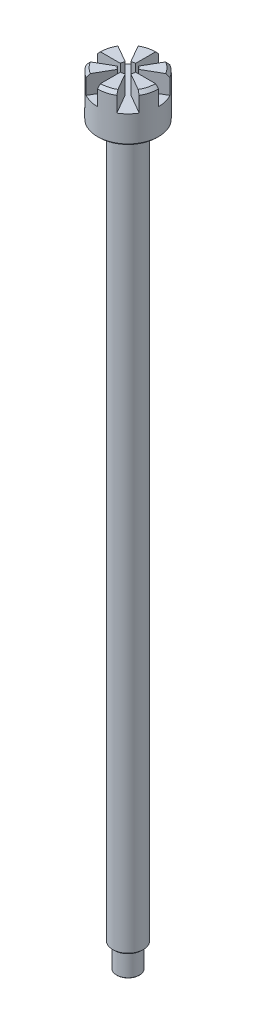
from build123d import *

# Parameters (mm, degrees)
CHAMFER1_SIZE      = 2
CUT_EXTRUDE1_DEPTH = 12
CIRPATTERN6_COUNT  = 6
CUT_EXTRUDE2_START = -12
SKETCH3_R          = 5
CUT_EXTRUDE2_DEPTH = 12
CHAMFER2_SIZE      = 1
SKETCH4_W          = 10
SKETCH4_H          = 510
SKETCH5_OUTSIDE_W  = 152.58
SKETCH5_OUTSIDE_H  = 152.58
SKETCH5_OUTSIDE_R  = 7.5
CUT_EXTRUDE3_DEPTH = 55
CHAMFER3_SIZE      = 1
SKETCH6_R          = 30.68966821
CUT_EXTRUDE4_DEPTH = 40
SKETCH7_R          = 6
CUT_EXTRUDE5_DEPTH = 25
CUT_EXTRUDE6_DEPTH = 25
CIRPATTERN7_COUNT  = 35
CHAMFER4_SIZE      = 0.3


with BuildPart() as part:
    # Sketch1 → Revolve1 (revolve)
    with BuildSketch(Plane.XY, mode=Mode.PRIVATE) as revolve1_sk:
        Polygon((0, 0), (0, 40), (20, 40), (20, 10), (10, 10), (10, 0), align=None)
    revolve(revolve1_sk.sketch.rotate(Axis((0, 0, 0), (0, 1, 0)), 90), axis=Axis((0, 0, 0), (0, 1, 0)))

    # Chamfer1
    chamfer1_edges = [part.edges().sort_by_distance(p)[0] for p in [
        (0, 40, 20),
    ]]
    chamfer(chamfer1_edges, length=CHAMFER1_SIZE)

    # Sketch2 → Cut-Extrude1 (cut)
    with BuildSketch(Plane(origin=(0, 40, 0), x_dir=(1, 0, 0), z_dir=(0, 1, 0))):
        with BuildLine():
            Line((0, 21.142627656), (0, 5))
            ThreePointArc((0, 5), (1.294095226, 4.829629131), (2.5, 4.330127019))
            Line((2.5, 4.330127019), (12.206701769, 21.142627656))
            Line((12.206701769, 21.142627656), (0, 21.142627656))
        make_face()
    cut_extrude1 = extrude(amount=-CUT_EXTRUDE1_DEPTH, mode=Mode.SUBTRACT)

    # CirPattern6: Cut-Extrude1 ×6 about axis
    cirpattern6_axis = Axis((0, 0, 0), (0, 1, 0))
    for i in range(1, CIRPATTERN6_COUNT):
        add(cut_extrude1.rotate(cirpattern6_axis, i * 360 / CIRPATTERN6_COUNT), mode=Mode.SUBTRACT)

    # Sketch3 → Cut-Extrude2 (cut)
    with BuildSketch(Plane(origin=(0, 40, 0), x_dir=(1, 0, 0), z_dir=(0, 1, 0)).offset(CUT_EXTRUDE2_START)):
        Circle(SKETCH3_R)
    extrude(amount=CUT_EXTRUDE2_DEPTH, mode=Mode.SUBTRACT)

    # Chamfer2
    chamfer2_edges = [part.edges().sort_by_distance(p)[0] for p in [
        (0, 10, 10),
        (0, 10, 20),
    ]]
    chamfer(chamfer2_edges, length=CHAMFER2_SIZE)

    # Sketch4 → Revolve2 (revolve)
    with BuildSketch(Plane.XY, mode=Mode.PRIVATE) as revolve2_sk:
        with Locations((5, -255)):
            Rectangle(SKETCH4_W, SKETCH4_H)
    revolve(revolve2_sk.sketch.rotate(Axis((0, 0, 0), (0, -1, 0)), 270), axis=Axis((0, 0, 0), (0, -1, 0)))

    # Sketch5 outside → Cut-Extrude3 (cut)
    with BuildSketch(Plane.XZ.offset(510)):
        Rectangle(SKETCH5_OUTSIDE_W, SKETCH5_OUTSIDE_H)
        Circle(SKETCH5_OUTSIDE_R, mode=Mode.SUBTRACT)
    extrude(amount=-CUT_EXTRUDE3_DEPTH, mode=Mode.SUBTRACT)

    # Chamfer3
    chamfer3_edges = [part.edges().sort_by_distance(p)[0] for p in [
        (0, -455, 10),
    ]]
    chamfer(chamfer3_edges, length=CHAMFER3_SIZE)

    # Sketch6 → Cut-Extrude4 (cut)
    with BuildSketch(Plane.XZ.offset(510)):
        Circle(SKETCH6_R)
    extrude(amount=-CUT_EXTRUDE4_DEPTH, mode=Mode.SUBTRACT)

    # Sketch7 → Cut-Extrude5 (cut)
    with BuildSketch(Plane.XZ.offset(470)):
        Circle(SKETCH7_R)
    extrude(amount=-CUT_EXTRUDE5_DEPTH, mode=Mode.SUBTRACT)

    # Sketch8 → Cut-Extrude6 (cut)
    with BuildSketch(Plane.XZ.offset(470)):
        Polygon((0, 6.174315781), (-1.45, 3.66284211), (1.45, 3.66284211), align=None)
    cut_extrude6 = extrude(amount=-CUT_EXTRUDE6_DEPTH, mode=Mode.SUBTRACT)

    # CirPattern7: Cut-Extrude6 ×35 about axis
    cirpattern7_axis = Axis((0, 0, 0), (0, 1, 0))
    for i in range(1, CIRPATTERN7_COUNT):
        add(cut_extrude6.rotate(cirpattern7_axis, i * 360 / CIRPATTERN7_COUNT), mode=Mode.SUBTRACT)

    # Chamfer4
    chamfer4_edges = [part.edges().sort_by_distance(p)[0] for p in [
        (-7.5, -470, 0),
    ]]
    chamfer(chamfer4_edges, length=CHAMFER4_SIZE)


solid = part.part
